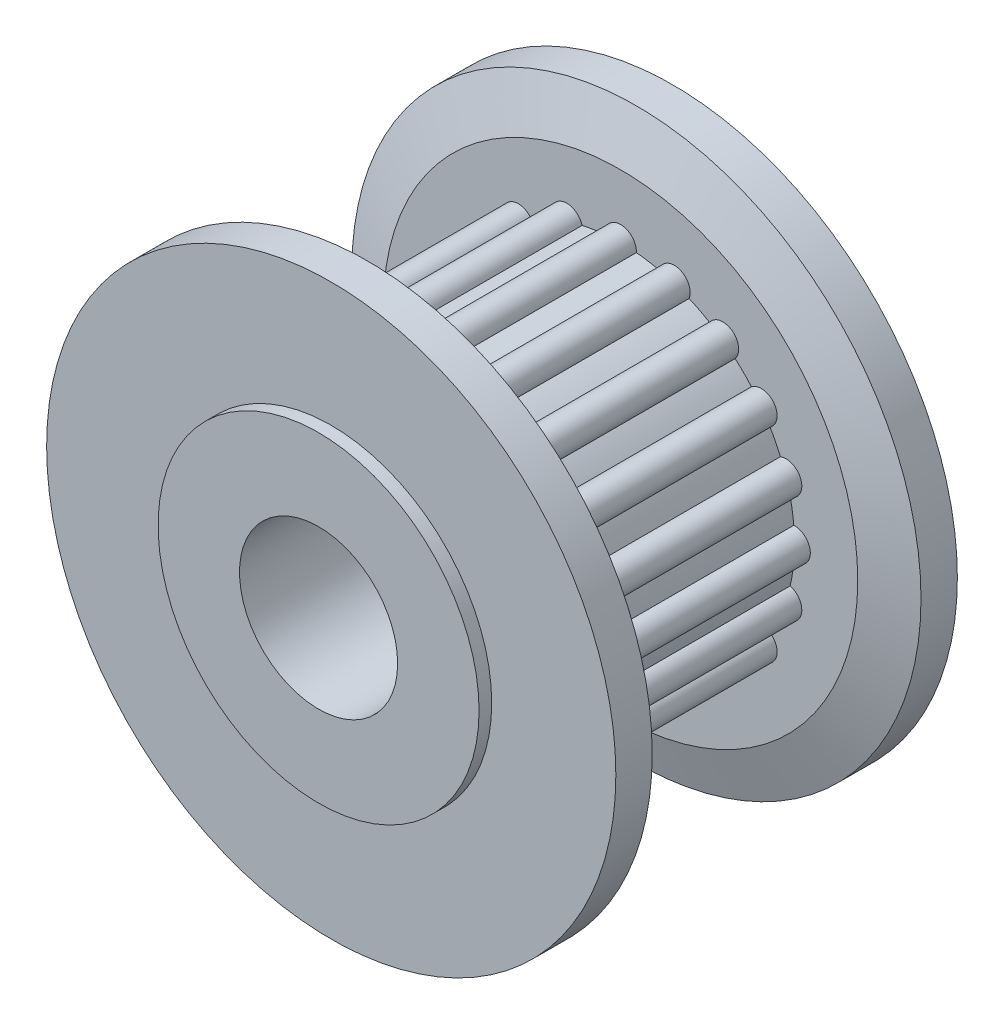
from build123d import *

# Parameters (mm, degrees)
BOSS_EXTRUDE1_DEPTH = 7.5
CIRPATTERN1_COUNT   = 20


with BuildPart() as part:
    # Sketch1 → Revolve1 (revolve)
    with BuildSketch(Plane(origin=(0, 0, 0), x_dir=(0, 0, -1), z_dir=(1, 0, 0)), mode=Mode.PRIVATE) as revolve1_sk:
        Polygon((-3.75, 7.5), (-3.75, 5.5), (3.75, 5.5), (3.75, 7.5), (4.25, 9), (5.4, 9), (5.4, 5.075), (5.8, 5.075), (5.8, 2.5), (-5.8, 2.5), (-5.8, 5.075), (-5.4, 5.075), (-5.4, 9), (-4.25, 9), align=None)
    revolve(revolve1_sk.sketch.rotate(Axis((0, 0, 0), (0, 0, -1)), 90), axis=Axis((0, 0, 0), (0, 0, -1)))

    # Sketch2 → Boss-Extrude1 (add)
    with BuildSketch(Plane.XY.offset(-3.75)):
        with BuildLine():
            ThreePointArc((0.499483204, 5.477272727), (0, 6), (-0.499483204, 5.477272727))
            ThreePointArc((-0.499483204, 5.477272727), (0, 5.5), (0.499483204, 5.477272727))
        make_face()
    boss_extrude1 = extrude(amount=BOSS_EXTRUDE1_DEPTH)

    # CirPattern1: Boss-Extrude1 ×20 about axis
    cirpattern1_axis = Axis((0, 0, 0), (0, 0, 1))
    for i in range(1, CIRPATTERN1_COUNT):
        add(boss_extrude1.rotate(cirpattern1_axis, i * 360 / CIRPATTERN1_COUNT))


solid = part.part
